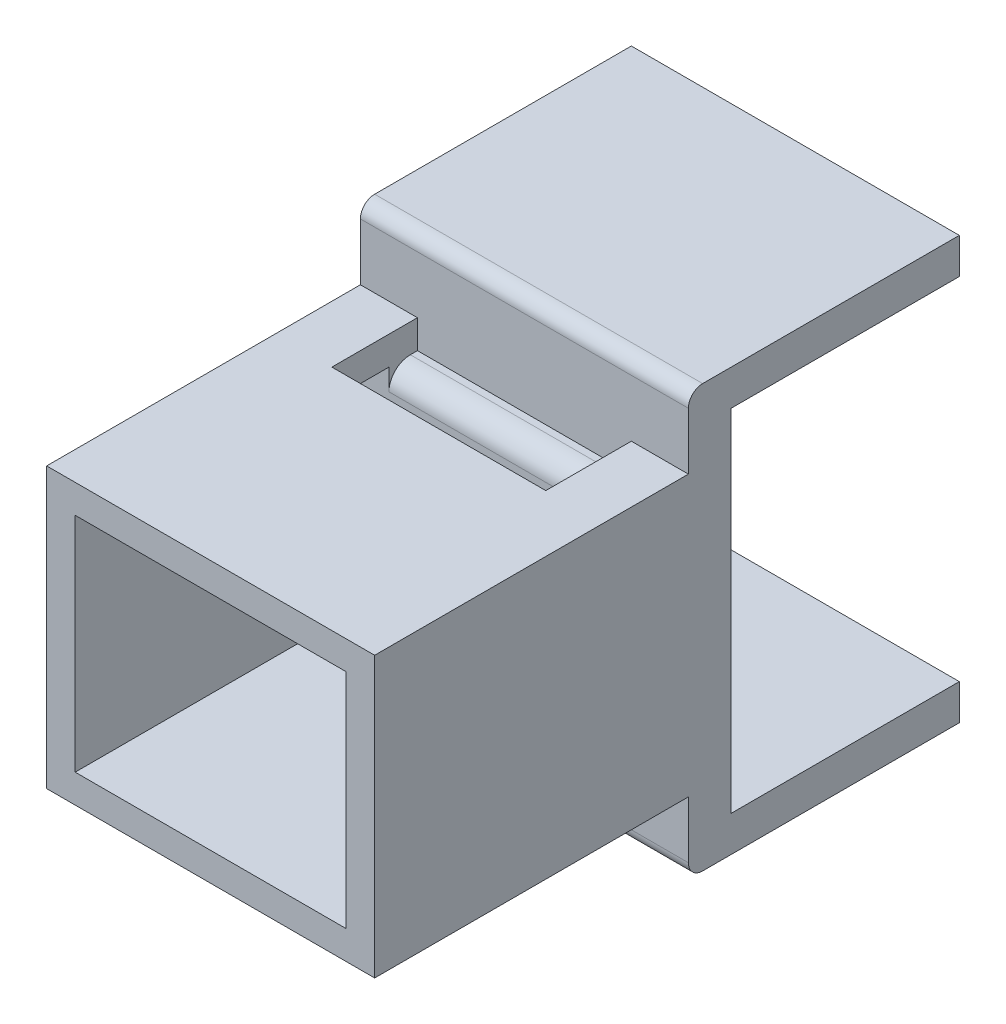
from build123d import *

# Parameters (mm, degrees)
ESQUISSE1_W             = 11.5
ESQUISSE1_H             = 9.8
BOSS_EXTRU_1_DEPTH      = 11
ESQUISSE2_W             = 9.5
ESQUISSE2_H             = 7.8
ENL_V_MAT_EXTRU_1_DEPTH = 10
ESQUISSE3_W             = 7.5
ESQUISSE3_H             = 3
ENL_V_MAT_EXTRU_2_DEPTH = 1
CONG_1_R                = 0.75
ESQUISSE4_W             = 11.5
ESQUISSE4_H             = 14.8
BOSS_EXTRU_2_DEPTH      = 1.5
ESQUISSE5_W             = 11.5
ESQUISSE5_H             = 1.25
BOSS_EXTRU_3_DEPTH      = 8
CONG_2_R                = 0.5


with BuildPart() as part:
    # Esquisse1 → Boss.-Extru.1 (new body)
    with BuildSketch(Plane.XY):
        with Locations((5.75, 4.9)):
            Rectangle(ESQUISSE1_W, ESQUISSE1_H)
    extrude(amount=BOSS_EXTRU_1_DEPTH)

    # Esquisse2 → Enlèv. mat.-Extru.1 (cut)
    with BuildSketch(Plane.XY.offset(11)):
        with Locations((5.75, 4.9)):
            Rectangle(ESQUISSE2_W, ESQUISSE2_H)
    extrude(amount=-ENL_V_MAT_EXTRU_1_DEPTH, mode=Mode.SUBTRACT)

    # Esquisse3 → Enlèv. mat.-Extru.2 (cut)
    with BuildSketch(Plane(origin=(0, 9.8, 0), x_dir=(1, 0, 0), z_dir=(0, 1, 0))):
        with Locations((5.75, -1.5)):
            Rectangle(ESQUISSE3_W, ESQUISSE3_H)
    extrude(amount=-ENL_V_MAT_EXTRU_2_DEPTH, mode=Mode.SUBTRACT)

    # Congé1
    cong_1_edges = [part.edges().sort_by_distance(p)[0] for p in [
        (5.75, 8.8, 1),
        (5.75, 8.8, 3),
    ]]
    fillet(cong_1_edges, radius=CONG_1_R)

    # Esquisse4 → Boss.-Extru.2 (add)
    with BuildSketch(Plane(origin=(0, 0, 0), x_dir=(-1, 0, 0), z_dir=(0, 0, -1))):
        with Locations((-5.75, 4.9)):
            Rectangle(ESQUISSE4_W, ESQUISSE4_H)
    extrude(amount=BOSS_EXTRU_2_DEPTH)

    # Esquisse5 → Boss.-Extru.3 (add)
    with BuildSketch(Plane(origin=(0, 0, -1.5), x_dir=(-1, 0, 0), z_dir=(0, 0, -1))):
        with Locations((-5.75, 11.675)):
            Rectangle(ESQUISSE5_W, ESQUISSE5_H)
        with Locations((-5.75, -1.875)):
            Rectangle(ESQUISSE5_W, ESQUISSE5_H)
    extrude(amount=BOSS_EXTRU_3_DEPTH)

    # Congé2
    cong_2_edges = [part.edges().sort_by_distance(p)[0] for p in [
        (5.75, -2.5, 0),
        (5.75, 12.3, 0),
    ]]
    fillet(cong_2_edges, radius=CONG_2_R)


solid = part.part
